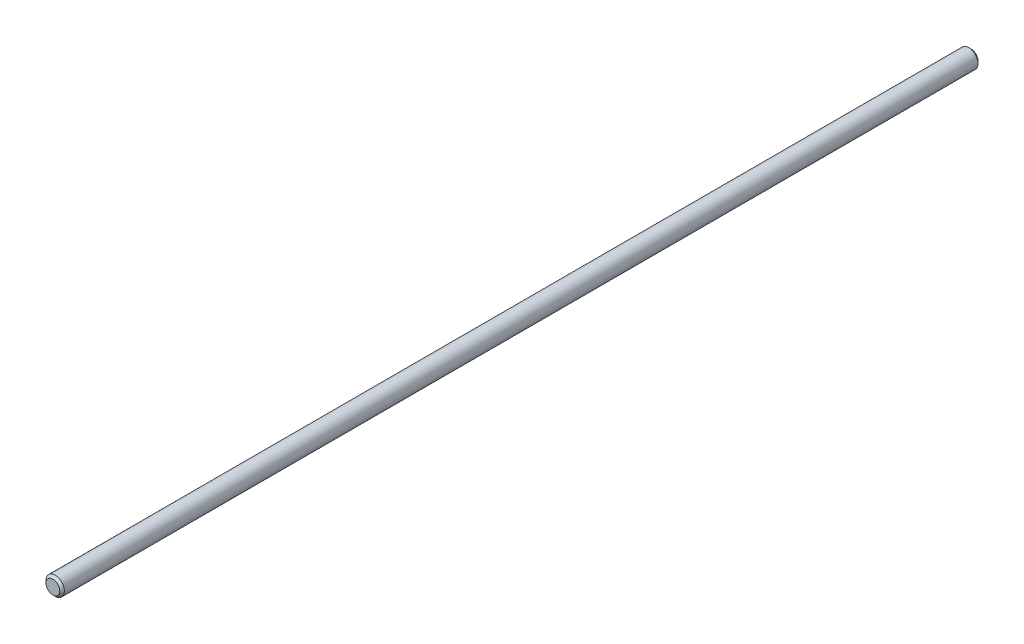
from build123d import *

# Parameters (mm, degrees)
SKETCH_1_R      = 2
EXTRUDE_1_DEPTH = 200
CHAMFER_1_SIZE  = 0.5


with BuildPart() as part:
    # 草图1 → 凸台-拉伸1 (new body)
    with BuildSketch(Plane.XY):
        Circle(SKETCH_1_R)
    extrude(amount=-EXTRUDE_1_DEPTH)

    # 倒角1
    chamfer_1_edges = [part.edges().sort_by_distance(p)[0] for p in [
        (-2, 0, 0),
        (-2, 0, -200),
    ]]
    chamfer(chamfer_1_edges, length=CHAMFER_1_SIZE)


solid = part.part
